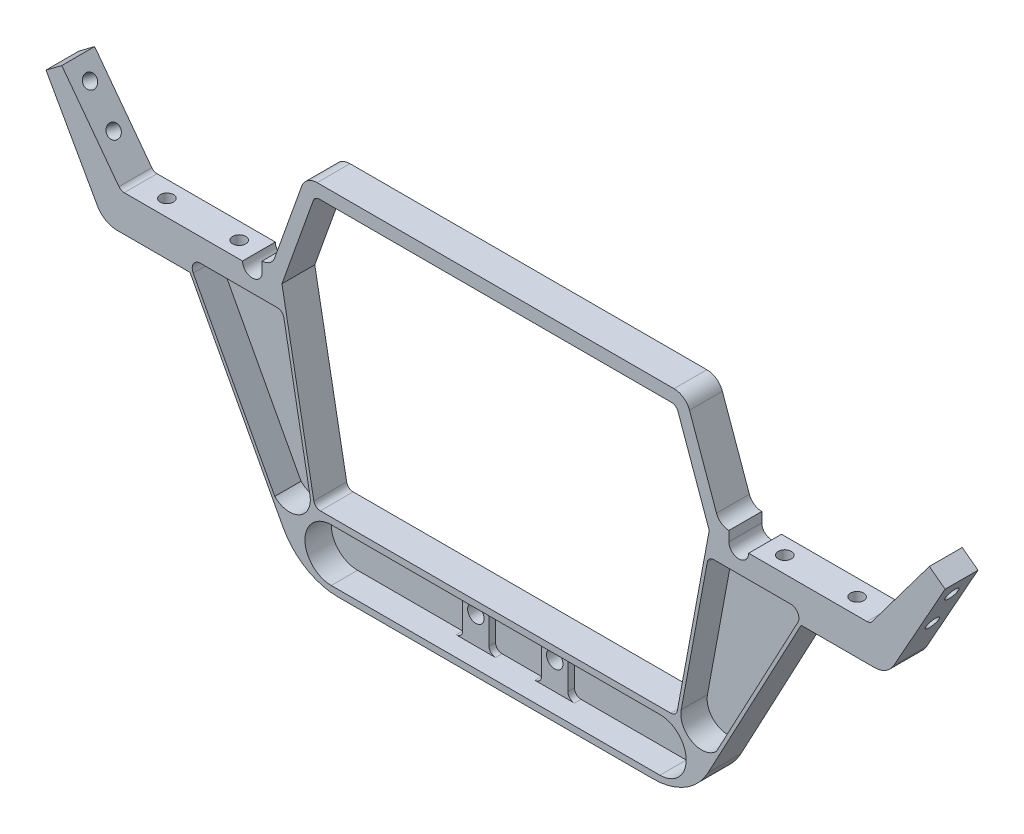
from build123d import *

# Parameters (mm, degrees)
CROQUIS1_W              = 138
CROQUIS1_H              = 53
SALIENTE_EXTRUIR1_DEPTH = 5
CROQUIS2_R              = 2.003620998
CROQUIS2_R_2            = 1.5
CROQUIS2_R_3            = 1.25
PRINCIPAL_DEPTH         = 5
CORTAR_EXTRUIR2_DEPTH   = 5
SALIENTE_EXTRUIR2_DEPTH = 5
CORTAR_EXTRUIR3_DEPTH   = 4
CROQUIS6_R              = 4
CORTAR_EXTRUIR4_DEPTH   = 4
SALIENTE_EXTRUIR3_START = 1
CROQUIS8_R              = 1.25
SALIENTE_EXTRUIR3_DEPTH = 1
CROQUIS9_R              = 1
CORTAR_EXTRUIR5_DEPTH   = 10
CROQUIS10_R             = 1
CORTAR_EXTRUIR6_DEPTH   = 10


with BuildPart() as part:
    # Croquis1 → Saliente-Extruir1 (new body)
    with BuildSketch(Plane.XY):
        Rectangle(CROQUIS1_W, CROQUIS1_H)
    extrude(amount=SALIENTE_EXTRUIR1_DEPTH)

    # Croquis2 → Principal (cut)
    with BuildSketch(Plane.XY.offset(5)):
        Polygon((-27.5, -16.5), (-32.5, 10.5), (-27.5, 24.5), (27.5, 24.5), (32.5, 10.5), (27.5, -16.5), align=None)
        with BuildLine():
            Line((-33.613106132, 13.32973033), (-28.909438392, 26.5))
            Line((-28.909438392, 26.5), (-69, 26.5))
            Line((-69, 26.5), (-69, -26.5))
            Line((-69, -26.5), (-29.659776055, -26.5))
            Line((-29.659776055, -26.5), (-46.481481481, 5))
            Line((-46.481481481, 5), (-59.600761168, 5))
            Line((-59.600761168, 5), (-68.394256163, 20.706415948))
            Line((-68.394256163, 20.706415948), (-65.993243243, 22.505064597))
            Line((-65.993243243, 22.505064597), (-57, 10.5))
            Line((-57, 10.5), (-38.5, 10.5))
            ThreePointArc((-38.5, 10.5), (-37, 12), (-35.5, 10.5))
            Line((-35.5, 10.5), (-35.5, 12))
            ThreePointArc((-35.5, 12), (-36.916773994, 15.420394992), (-33.496379002, 14.003620998))
            ThreePointArc((-33.496379002, 14.003620998), (-33.525776447, 13.661658334), (-33.613106132, 13.32973033))
        make_face()
        with BuildLine():
            Line((28.909438392, 26.5), (33.613106132, 13.32973033))
            ThreePointArc((33.613106132, 13.32973033), (35.158037336, 15.977844551), (37.503620998, 14.003620998))
            ThreePointArc((37.503620998, 14.003620998), (36.916773994, 12.586847003), (35.5, 12))
            Line((35.5, 12), (35.5, 10.5))
            ThreePointArc((35.5, 10.5), (37, 12), (38.5, 10.5))
            Line((38.5, 10.5), (57, 10.5))
            Line((57, 10.5), (65.993243243, 22.505064597))
            Line((65.993243243, 22.505064597), (68.394256163, 20.706415948))
            Line((68.394256163, 20.706415948), (59.600761168, 5))
            Line((59.600761168, 5), (46.481481481, 5))
            Line((46.481481481, 5), (29.659776055, -26.5))
            Line((29.659776055, -26.5), (69, -26.5))
            Line((69, -26.5), (69, 26.5))
            Line((69, 26.5), (28.909438392, 26.5))
        make_face()
        with Locations((-35.5, 14.003620998)):
            Circle(CROQUIS2_R)
        with Locations((35.5, 14.003620998)):
            Circle(CROQUIS2_R)
        with Locations((37, 10.5)):
            Circle(CROQUIS2_R_2)
        with Locations((-37, 10.5)):
            Circle(CROQUIS2_R_2)
        with Locations((-6, -21.25)):
            Circle(CROQUIS2_R_3)
        with Locations((6, -21.25)):
            Circle(CROQUIS2_R_3)
    extrude(amount=-PRINCIPAL_DEPTH, mode=Mode.SUBTRACT)

    # Croquis3 → Cortar-Extruir2 (cut)
    with BuildSketch(Plane.XY.offset(5)):
        with BuildLine():
            ThreePointArc((32.325878128, -21.50750886), (28.853998723, -25.156220871), (24, -26.5))
            Line((24, -26.5), (29.659776055, -26.5))
            Line((29.659776055, -26.5), (32.325878128, -21.50750886))
        make_face()
        with BuildLine():
            ThreePointArc((60.578021878, 6.745524755), (59.326103094, 5.468546056), (57.600287393, 5))
            Line((57.600287393, 5), (59.600761168, 5))
            Line((59.600761168, 5), (60.578021878, 6.745524755))
        make_face()
        with BuildLine():
            Line((28.909438392, 26.5), (27.147640402, 26.5))
            ThreePointArc((27.147640402, 26.5), (28.587761459, 26.043538926), (29.501995152, 24.840841072))
            Line((29.501995152, 24.840841072), (28.909438392, 26.5))
        make_face()
    cortar_extruir2 = extrude(amount=-CORTAR_EXTRUIR2_DEPTH, mode=Mode.SUBTRACT)

    # Simetría2: Cortar-Extruir2 across plane
    add(cortar_extruir2.mirror(Plane(origin=(0, 0, 0), x_dir=(0, 0, 1), z_dir=(1, 0, 0))), mode=Mode.SUBTRACT)

    # Croquis4 → Saliente-Extruir2 (add)
    with BuildSketch(Plane.XY.offset(5)):
        with BuildLine():
            ThreePointArc((27.651464932, -15.682089366), (27.30767909, -16.268794305), (26.668182947, -16.5))
            Line((26.668182947, -16.5), (27.5, -16.5))
            Line((27.5, -16.5), (27.651464932, -15.682089366))
        make_face()
        with BuildLine():
            ThreePointArc((26.795280804, 24.5), (27.371329386, 24.317415458), (27.737022835, 23.836336061))
            Line((27.737022835, 23.836336061), (27.5, 24.5))
            Line((27.5, 24.5), (26.795280804, 24.5))
        make_face()
        with BuildLine():
            ThreePointArc((57.299985699, 10.900450382), (56.947113406, 10.605698704), (56.49964811, 10.5))
            Line((56.49964811, 10.5), (57, 10.5))
            Line((57, 10.5), (57.299985699, 10.900450382))
        make_face()
    saliente_extruir2 = extrude(amount=-SALIENTE_EXTRUIR2_DEPTH)

    # Simetría3: Saliente-Extruir2 across plane
    add(saliente_extruir2.mirror(Plane(origin=(0, 0, 0), x_dir=(0, 0, 1), z_dir=(1, 0, 0))))

    # Croquis5 → Cortar-Extruir3 (cut)
    with BuildSketch(Plane.XY.offset(5)):
        with BuildLine():
            Line((32.208888015, 6.182089238), (28.238577223, -15.257589037))
            ThreePointArc((28.238577223, -15.257589037), (29.881835098, -18.638168181), (33.596848928, -18.066080749))
            Line((33.596848928, -18.066080749), (46.000722714, 5.161173227))
            ThreePointArc((46.000722714, 5.161173227), (45.970135784, 6.392832223), (44.898097197, 7))
            Line((44.898097197, 7), (33.192170024, 7))
            ThreePointArc((33.192170024, 7), (32.552673831, 6.768794263), (32.208888015, 6.182089238))
        make_face()
    cortar_extruir3 = extrude(amount=-CORTAR_EXTRUIR3_DEPTH, mode=Mode.SUBTRACT)

    # Simetría4: Cortar-Extruir3 across plane
    add(cortar_extruir3.mirror(Plane(origin=(0, 0, 0), x_dir=(0, 0, 1), z_dir=(1, 0, 0))), mode=Mode.SUBTRACT)

    # Croquis6 → Cortar-Extruir4 (cut)
    with BuildSketch(Plane.XY.offset(5)):
        with Locations((-25, -21.5)):
            Circle(CROQUIS6_R)
        with BuildLine():
            Line((25, -17.5), (-25, -17.5))
            ThreePointArc((-25, -17.5), (-22.171572875, -18.671572875), (-21, -21.5))
            ThreePointArc((-21, -21.5), (-22.171572875, -24.328427125), (-25, -25.5))
            Line((-25, -25.5), (25, -25.5))
            ThreePointArc((25, -25.5), (21, -21.5), (25, -17.5))
        make_face()
        with Locations((25, -21.5)):
            Circle(CROQUIS6_R)
    extrude(amount=-CORTAR_EXTRUIR4_DEPTH, mode=Mode.SUBTRACT)

    # Croquis8 → Saliente-Extruir3 (add)
    # profile 1 of 5: a face of its own
    with BuildSketch(Plane.XY.offset(1).offset(SALIENTE_EXTRUIR3_START)):
        with BuildLine():
            Line((4, -18.5), (4, -17.5))
            Line((4, -17.5), (3, -17.5))
            ThreePointArc((3, -17.5), (3.707106781, -17.792893219), (4, -18.5))
        make_face()
    # profile 2 of 5: a face of its own
    with BuildSketch(Plane.XY.offset(1).offset(SALIENTE_EXTRUIR3_START)):
        Polygon((8, -17.5), (4, -17.5), (4, -18.5), (4, -24.5), (4, -25.5), (8, -25.5), (8, -24.5), (8, -18.5), align=None)
        with Locations((6, -21.25)):
            Circle(CROQUIS8_R, mode=Mode.SUBTRACT)
    # profile 3 of 5: a face of its own
    with BuildSketch(Plane.XY.offset(1).offset(SALIENTE_EXTRUIR3_START)):
        with BuildLine():
            Line((9, -17.5), (8, -17.5))
            Line((8, -17.5), (8, -18.5))
            ThreePointArc((8, -18.5), (8.292893219, -17.792893219), (9, -17.5))
        make_face()
    # profile 4 of 5: a face of its own
    with BuildSketch(Plane.XY.offset(1).offset(SALIENTE_EXTRUIR3_START)):
        with BuildLine():
            ThreePointArc((9, -25.5), (8.292893219, -25.207106781), (8, -24.5))
            Line((8, -24.5), (8, -25.5))
            Line((8, -25.5), (9, -25.5))
        make_face()
    # profile 5 of 5: a face of its own
    with BuildSketch(Plane.XY.offset(1).offset(SALIENTE_EXTRUIR3_START)):
        with BuildLine():
            Line((4, -25.5), (4, -24.5))
            ThreePointArc((4, -24.5), (3.707106781, -25.207106781), (3, -25.5))
            Line((3, -25.5), (4, -25.5))
        make_face()
    saliente_extruir3 = extrude(amount=-SALIENTE_EXTRUIR3_DEPTH)

    # Simetría5: Saliente-Extruir3 across plane
    add(saliente_extruir3.mirror(Plane(origin=(0, 0, 0), x_dir=(0, 0, 1), z_dir=(1, 0, 0))))

    # Croquis9 → Cortar-Extruir5 (cut)
    with BuildSketch(Plane(origin=(31.472457495, -23.576671616, 0), x_dir=(0, 0, 1), z_dir=(-0.8003376397714477, 0.5995495495495503, 0))):
        with Locations(Location((2.5, 54.577869542, 0), (0, 0, 270))):
            Circle(CROQUIS9_R)
        with Locations(Location((2.5, 48.577869542, 0), (0, 0, 270))):
            Circle(CROQUIS9_R)
    cortar_extruir5 = extrude(amount=-CORTAR_EXTRUIR5_DEPTH, mode=Mode.SUBTRACT)

    # Simetría6: Cortar-Extruir5 across plane
    add(cortar_extruir5.mirror(Plane(origin=(0, 0, 0), x_dir=(0, 0, 1), z_dir=(1, 0, 0))), mode=Mode.SUBTRACT)

    # Croquis10 → Cortar-Extruir6 (cut)
    with BuildSketch(Plane(origin=(0, 10.5, 0), x_dir=(1, 0, 0), z_dir=(0, 1, 0))):
        with Locations(Location((52.5, -2.5, 0), (0, 0, 270))):
            Circle(CROQUIS10_R)
        with Locations(Location((41.5, -2.5, 0), (0, 0, 270))):
            Circle(CROQUIS10_R)
    cortar_extruir6 = extrude(amount=-CORTAR_EXTRUIR6_DEPTH, mode=Mode.SUBTRACT)

    # Simetría7: Cortar-Extruir6 across plane
    add(cortar_extruir6.mirror(Plane(origin=(0, 0, 0), x_dir=(0, 0, 1), z_dir=(1, 0, 0))), mode=Mode.SUBTRACT)


solid = part.part
